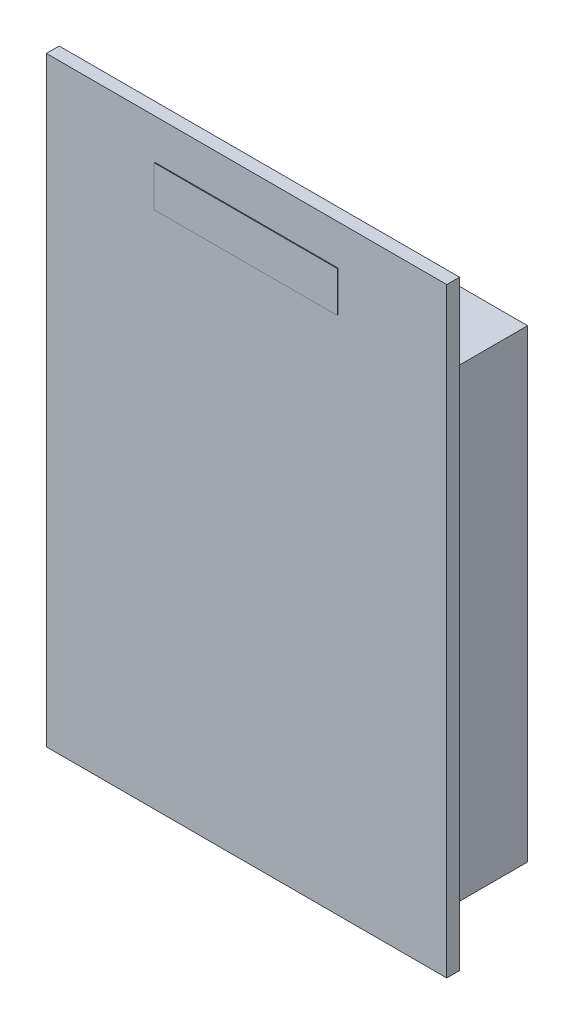
from build123d import *

# Parameters (mm, degrees)
SKETCH1_W           = 50
SKETCH1_H           = 75
BOSS_EXTRUDE1_DEPTH = 1.6
SKETCH3_W           = 22.86
SKETCH3_H           = 5.08
BOSS_EXTRUDE2_DEPTH = 0.1
SKETCH6_W           = 35
SKETCH6_H           = 58
BOSS_EXTRUDE3_DEPTH = 16


with BuildPart() as part:
    # Sketch1 → Boss-Extrude1 (new body)
    with BuildSketch(Plane.XY):
        Rectangle(SKETCH1_W, SKETCH1_H)
    extrude(amount=BOSS_EXTRUDE1_DEPTH)

    # Sketch3 → Boss-Extrude2 (add)
    with BuildSketch(Plane.XY.offset(1.6)):
        with Locations((0, 29.96)):
            Rectangle(SKETCH3_W, SKETCH3_H)
    extrude(amount=BOSS_EXTRUDE2_DEPTH)

    # Sketch6 → Boss-Extrude3 (add)
    with BuildSketch(Plane(origin=(0, 0, 0), x_dir=(-1, 0, 0), z_dir=(0, 0, -1))):
        with Locations((0, -8.5)):
            Rectangle(SKETCH6_W, SKETCH6_H)
    extrude(amount=BOSS_EXTRUDE3_DEPTH)


solid = part.part
